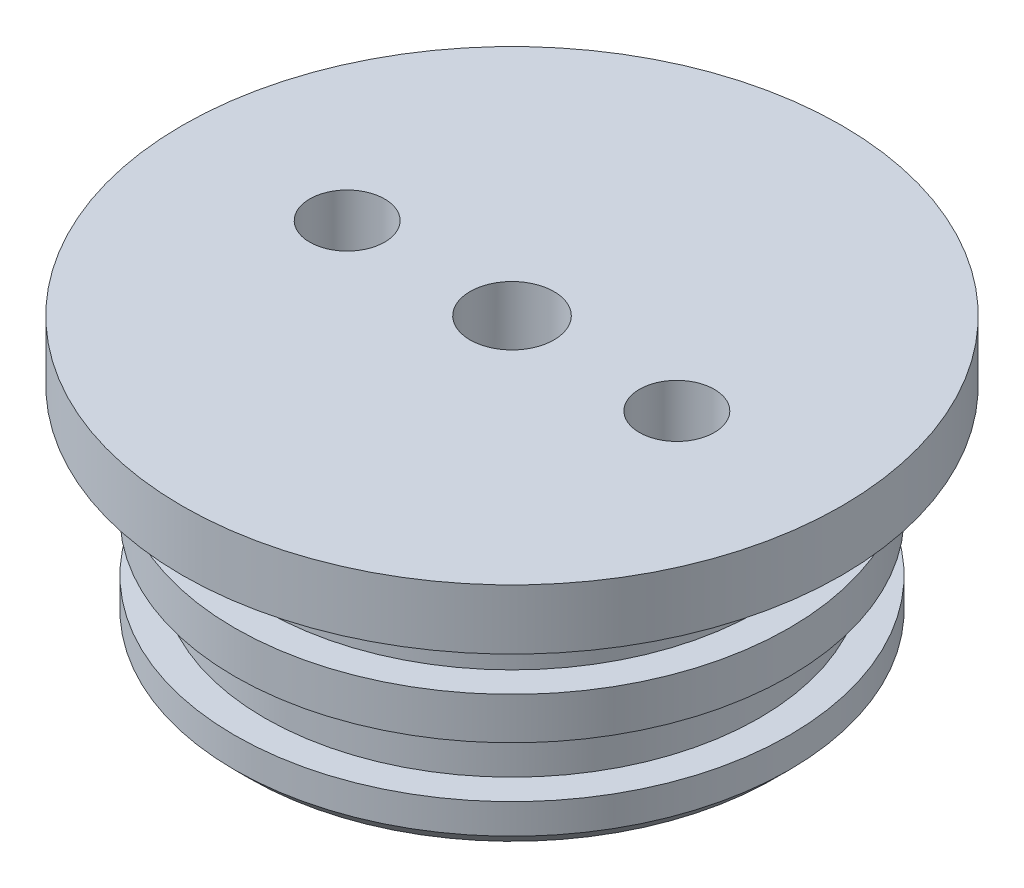
from build123d import *

# Parameters (mm, degrees)
SKETCH_1_R          = 11
EXTRUDE_1_DEPTH     = 9
SKETCH_2_R          = 0.5
CUT_EXTRUDE_1_DEPTH = 18.972200756
SKETCH_3_R          = 16.549134696
SKETCH_3_R_2        = 9.25
CUT_EXTRUDE_2_DEPTH = 7
SKETCH_4_W          = 2
SKETCH_4_H          = 1.7
SKETCH_5_W          = 5
SKETCH_5_H          = 6
CUT_EXTRUDE_3_DEPTH = 7
SKETCH_6_R          = 1.4
CUT_EXTRUDE_4_DEPTH = 7
SKETCH_7_R          = 1.25
CUT_EXTRUDE_5_DEPTH = 2.5
CUT_EXTRUDE_START   = -1.5
SKETCH_8_R          = 1.25
CUT_EXTRUDE_6_DEPTH = 1.5
SKETCH_9_W          = 7
SKETCH_9_H          = 8
SKETCH_9_W_2        = 5
SKETCH_9_H_2        = 6
CUT_EXTRUDE_7_DEPTH = 2
CHAMFER_1_SIZE      = 0.5


with BuildPart() as part:
    # 草图1 → 凸台-拉伸1 (new body)
    with BuildSketch(Plane(origin=(0, 0, 0), x_dir=(1, 0, 0), z_dir=(0, 1, 0))):
        with Locations(Location((0, 0, 0), (0, 0, 270))):
            Circle(SKETCH_1_R)
    extrude(amount=EXTRUDE_1_DEPTH)

    # 草图2 → 切除-拉伸1 (cut, through all)
    with BuildSketch(Plane(origin=(0, 9, 0), x_dir=(1, 0, 0), z_dir=(0, 1, 0))):
        with Locations(Location((-5.5, 0, 0), (0, 0, 270))):
            Circle(SKETCH_2_R)
        with Locations(Location((5.5, 0, 0), (0, 0, 270))):
            Circle(SKETCH_2_R)
    extrude(amount=-CUT_EXTRUDE_1_DEPTH, mode=Mode.SUBTRACT)

    # 草图3 → 切除-拉伸2 (cut)
    with BuildSketch(Plane.XZ):
        Circle(SKETCH_3_R)
        with Locations(Location((0, 0, 0), (0, 0, 270))):
            Circle(SKETCH_3_R_2, mode=Mode.SUBTRACT)
    extrude(amount=-CUT_EXTRUDE_2_DEPTH, mode=Mode.SUBTRACT)

    # 草图4 → 切除-旋转1 (revolve, cut)
    with BuildSketch(Plane.XY, mode=Mode.PRIVATE) as cut_revolve_1_sk:
        with Locations((-9.25, 5.45)):
            Rectangle(SKETCH_4_W, SKETCH_4_H)
        with Locations((-9.25, 2.35)):
            Rectangle(SKETCH_4_W, SKETCH_4_H)
    revolve(cut_revolve_1_sk.sketch.rotate(Axis((0, 0, 0), (0, 1, 0)), 270), axis=Axis((0, 0, 0), (0, 1, 0)), mode=Mode.SUBTRACT)

    # 草图5 → 切除-拉伸3 (cut)
    with BuildSketch(Plane.XZ):
        Rectangle(SKETCH_5_W, SKETCH_5_H)
    extrude(amount=-CUT_EXTRUDE_3_DEPTH, mode=Mode.SUBTRACT)

    # 草图6 → 切除-拉伸4 (cut)
    with BuildSketch(Plane(origin=(0, 9, 0), x_dir=(1, 0, 0), z_dir=(0, 1, 0))):
        with Locations(Location((0, 0, 0), (0, 0, 270))):
            Circle(SKETCH_6_R)
    extrude(amount=-CUT_EXTRUDE_4_DEPTH, mode=Mode.SUBTRACT)

    # 草图7 → 切除-拉伸5 (cut)
    with BuildSketch(Plane(origin=(0, 9, 0), x_dir=(1, 0, 0), z_dir=(0, 1, 0))):
        with Locations(Location((-5.5, 0, 0), (0, 0, 270))):
            Circle(SKETCH_7_R)
        with Locations(Location((5.5, 0, 0), (0, 0, 270))):
            Circle(SKETCH_7_R)
    extrude(amount=-CUT_EXTRUDE_5_DEPTH, mode=Mode.SUBTRACT)

    # 草图8 → 切除-拉伸6 (cut)
    with BuildSketch(Plane.XZ.offset(CUT_EXTRUDE_START)):
        with Locations(Location((-5.5, 0, 0), (0, 0, 90))):
            Circle(SKETCH_8_R)
        with Locations(Location((5.5, 0, 0), (0, 0, 90))):
            Circle(SKETCH_8_R)
    extrude(amount=CUT_EXTRUDE_6_DEPTH, mode=Mode.SUBTRACT)

    # 草图9 → 切除-拉伸7 (cut)
    with BuildSketch(Plane.XZ):
        Rectangle(SKETCH_9_W, SKETCH_9_H)
        Rectangle(SKETCH_9_W_2, SKETCH_9_H_2, mode=Mode.SUBTRACT)
    extrude(amount=-CUT_EXTRUDE_7_DEPTH, mode=Mode.SUBTRACT)

    # 倒角1
    chamfer_1_edges = [part.edges().sort_by_distance(p)[0] for p in [
        (0, 0, 9.25),
    ]]
    chamfer(chamfer_1_edges, length=CHAMFER_1_SIZE)


solid = part.part
